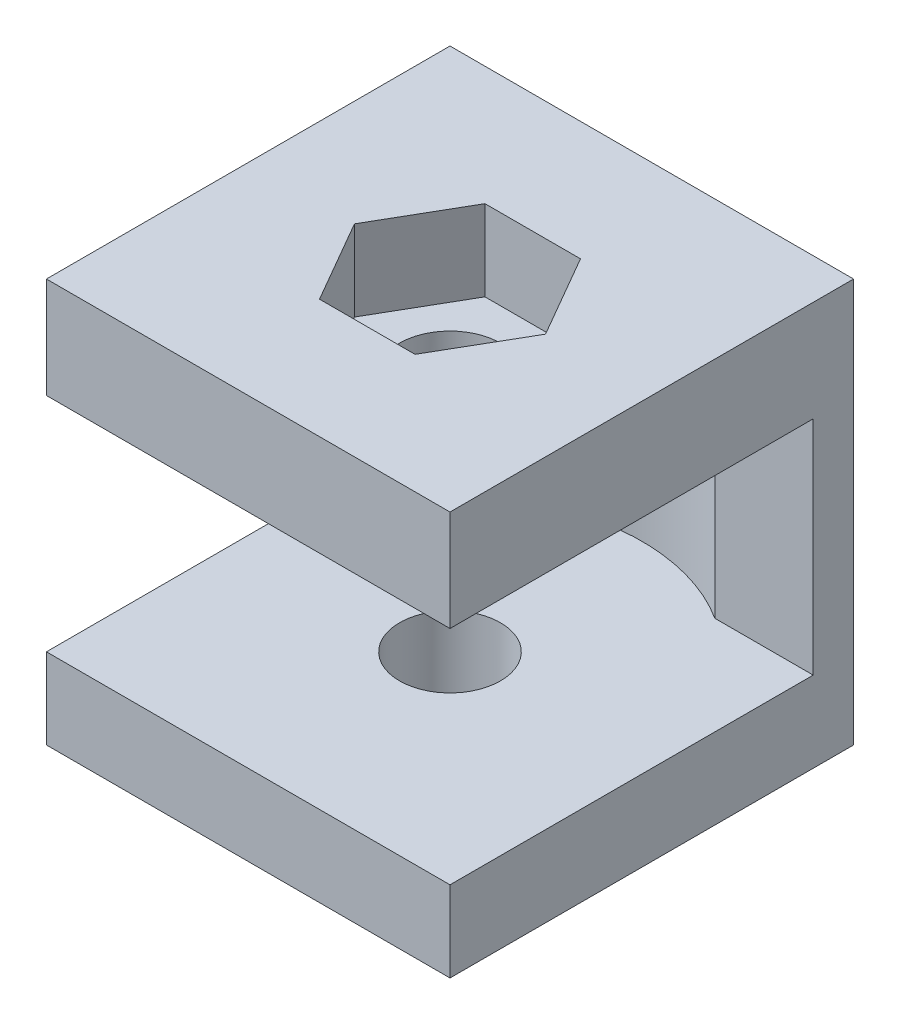
from build123d import *

# Parameters (mm, degrees)
SZKIC1_W                    = 20
SZKIC1_H                    = 20
DODANIE_WYCI_GNI_CIE1_DEPTH = 2
SZKIC2_R                    = 1.75
WYTNIJ_WYCI_GNI_CIE1_DEPTH  = 15.282856857
SZKIC3_W                    = 20
SZKIC3_H                    = 5
SZKIC3_H_2                  = 4
DODANIE_WYCI_GNI_CIE2_DEPTH = 18
SZKIC4_R                    = 2.5
WYTNIJ_WYCI_GNI_CIE2_DEPTH  = 31
WYTNIJ_WYCI_GNI_CIE3_DEPTH  = 4
WYTNIJ_WYCI_GNI_CIE5_START  = -4
SZKIC7_R                    = 9.5
WYTNIJ_WYCI_GNI_CIE5_DEPTH  = 11


with BuildPart() as part:
    # Szkic1 → Dodanie-wyciągnięcie1 (new body)
    with BuildSketch(Plane.XY):
        Rectangle(SZKIC1_W, SZKIC1_H)
    extrude(amount=DODANIE_WYCI_GNI_CIE1_DEPTH)

    # Szkic2 → Wytnij-wyciągnięcie1 (cut, through all)
    with BuildSketch(Plane.XY.offset(2)):
        Circle(SZKIC2_R)
    extrude(amount=-WYTNIJ_WYCI_GNI_CIE1_DEPTH, mode=Mode.SUBTRACT)

    # Szkic3 → Dodanie-wyciągnięcie2 (add)
    with BuildSketch(Plane.XY.offset(2)):
        with Locations((0, 7.5)):
            Rectangle(SZKIC3_W, SZKIC3_H)
        with Locations((0, -8)):
            Rectangle(SZKIC3_W, SZKIC3_H_2)
    extrude(amount=DODANIE_WYCI_GNI_CIE2_DEPTH)

    # Szkic4 → Wytnij-wyciągnięcie2 (cut, through all)
    with BuildSketch(Plane(origin=(0, 10, 0), x_dir=(1, 0, 0), z_dir=(0, 1, 0))):
        with Locations(Location((0, -10, 0), (0, 0, 270))):
            Circle(SZKIC4_R)
    extrude(amount=-WYTNIJ_WYCI_GNI_CIE2_DEPTH, mode=Mode.SUBTRACT)

    # Szkic6 → Wytnij-wyciągnięcie3 (cut)
    with BuildSketch(Plane(origin=(0, 10, 0), x_dir=(1, 0, 0), z_dir=(0, 1, 0))):
        Polygon((4.734272207, -10), (2.367136104, -5.9), (-2.367136104, -5.9), (-4.734272207, -10), (-2.367136104, -14.1), (2.367136104, -14.1), align=None)
    extrude(amount=-WYTNIJ_WYCI_GNI_CIE3_DEPTH, mode=Mode.SUBTRACT)

    # Szkic7 → Wytnij-wyciągnięcie5 (cut)
    with BuildSketch(Plane.XZ.offset(10).offset(WYTNIJ_WYCI_GNI_CIE5_START)):
        with Locations((0, 10)):
            Circle(SZKIC7_R)
    extrude(amount=-WYTNIJ_WYCI_GNI_CIE5_DEPTH, mode=Mode.SUBTRACT)


solid = part.part
